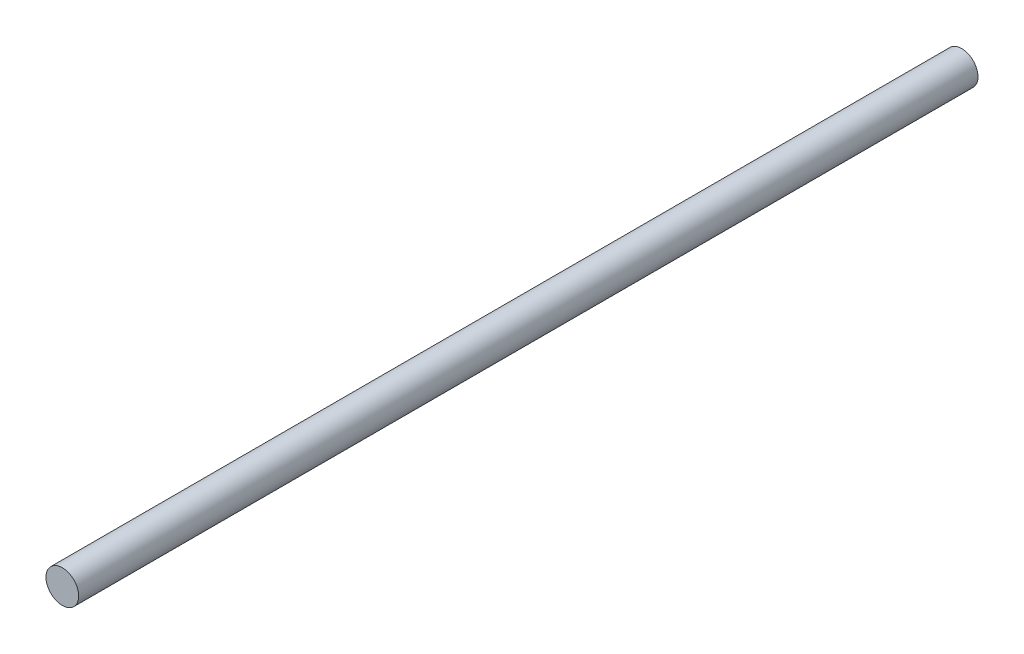
from build123d import *

# Parameters (mm, degrees)
SKETCH_1_R      = 1
EXTRUDE_1_DEPTH = 55


with BuildPart() as part:
    # 草图1 → 凸台-拉伸1 (new body)
    with BuildSketch(Plane.XY):
        Circle(SKETCH_1_R)
    extrude(amount=EXTRUDE_1_DEPTH)


solid = part.part
